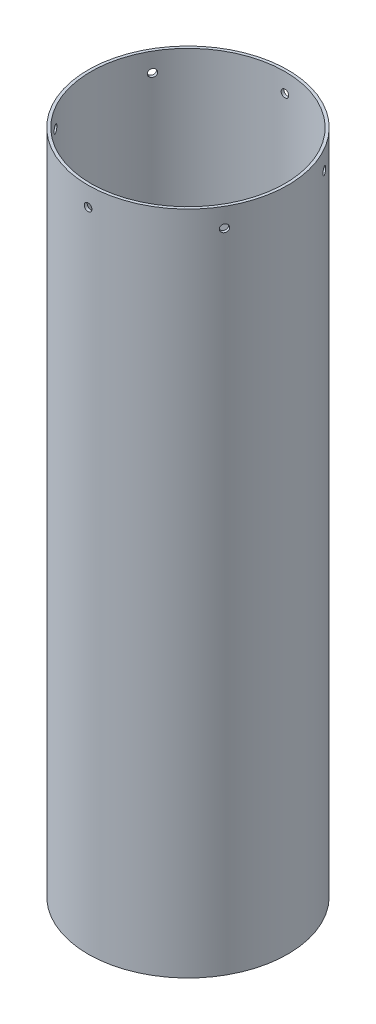
from build123d import *

# Parameters (mm, degrees)
SKETCH_1_R               = 52.5
SKETCH_1_R_2             = 51
EXTRUDE_1_DEPTH          = 350
SKETCH_2_R               = 2
CUT_EXTRUDE_1_DEPTH      = 64
PATTERN_CIRCULAR_1_COUNT = 6


with BuildPart() as part:
    # Эскиз1 → Бобышка-Вытянуть1 (new body)
    with BuildSketch(Plane(origin=(0, 0, 0), x_dir=(1, 0, 0), z_dir=(0, 1, 0))):
        with Locations(Location((0, 0, 0), (0, 0, 270))):
            Circle(SKETCH_1_R)
        with Locations(Location((0, 0, 0), (0, 0, 270))):
            Circle(SKETCH_1_R_2, mode=Mode.SUBTRACT)
    extrude(amount=EXTRUDE_1_DEPTH)

    # Эскиз2 → Вырез-Вытянуть1 (cut)
    with BuildSketch(Plane.XY):
        with Locations(Location((0, 340, 0), (0, 0, 180))):
            Circle(SKETCH_2_R)
    cut_extrude_1 = extrude(amount=CUT_EXTRUDE_1_DEPTH, mode=Mode.SUBTRACT)

    # Круговой массив1: Вырез-Вытянуть1 ×6 about axis
    pattern_circular_1_axis = Axis((0, 350, 0), (0, -1, 0))
    for i in range(1, PATTERN_CIRCULAR_1_COUNT):
        add(cut_extrude_1.rotate(pattern_circular_1_axis, i * 360 / PATTERN_CIRCULAR_1_COUNT), mode=Mode.SUBTRACT)


solid = part.part
